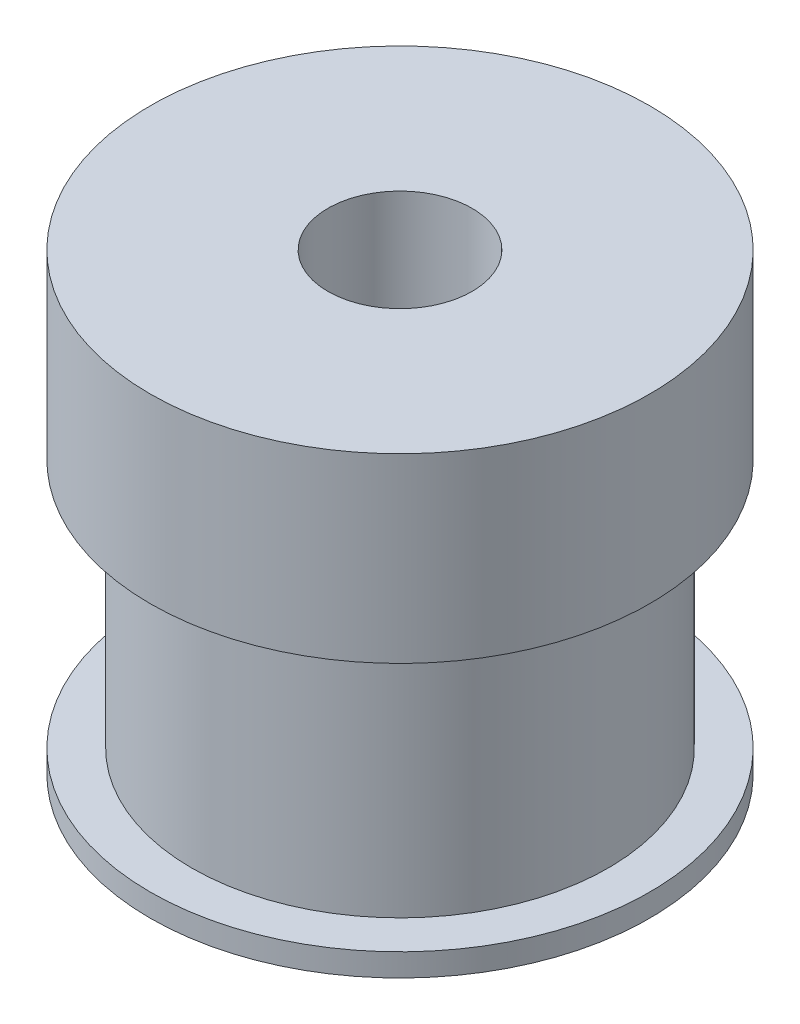
from build123d import *

# Parameters (mm, degrees)
SKETCH_1_R          = 11
EXTRUDE_1_DEPTH     = 1
SKETCH_2_R          = 9.17
EXTRUDE_2_DEPTH     = 11
SKETCH_3_R          = 11
EXTRUDE_3_DEPTH     = 8
SKETCH_4_R          = 3.175
CUT_EXTRUDE_1_DEPTH = 26.337718919


with BuildPart() as part:
    # Эскиз1 → Бобышка-Вытянуть1 (new body)
    with BuildSketch(Plane(origin=(0, 0, 0), x_dir=(1, 0, 0), z_dir=(0, 1, 0))):
        with Locations(Location((0, 0, 0), (0, 0, 270))):
            Circle(SKETCH_1_R)
    extrude(amount=EXTRUDE_1_DEPTH)

    # Эскиз2 → Бобышка-Вытянуть2 (add)
    with BuildSketch(Plane(origin=(0, 1, 0), x_dir=(1, 0, 0), z_dir=(0, 1, 0))):
        with Locations(Location((0, 0, 0), (0, 0, 270))):
            Circle(SKETCH_2_R)
    extrude(amount=EXTRUDE_2_DEPTH)

    # Эскиз3 → Бобышка-Вытянуть3 (add)
    with BuildSketch(Plane(origin=(0, 12, 0), x_dir=(1, 0, 0), z_dir=(0, 1, 0))):
        with Locations(Location((0, 0, 0), (0, 0, 270))):
            Circle(SKETCH_3_R)
    extrude(amount=EXTRUDE_3_DEPTH)

    # Эскиз4 → Вырез-Вытянуть1 (cut, through all)
    with BuildSketch(Plane(origin=(0, 20, 0), x_dir=(1, 0, 0), z_dir=(0, 1, 0))):
        with Locations(Location((0, 0, 0), (0, 0, 270))):
            Circle(SKETCH_4_R)
    extrude(amount=-CUT_EXTRUDE_1_DEPTH, mode=Mode.SUBTRACT)


solid = part.part
